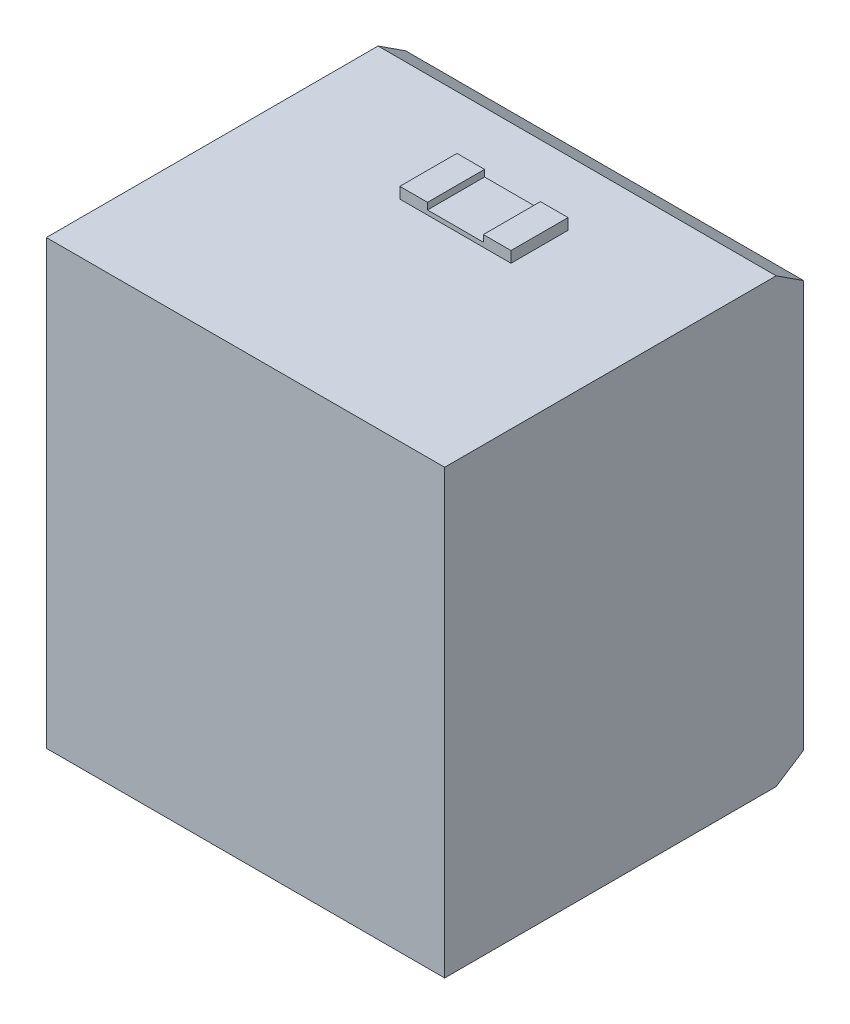
from build123d import *

# Parameters (mm, degrees)
BOSS_EXTRUDE1_DEPTH  = 1016
SKETCH2_W            = 834.909944441
SKETCH2_H            = 965.348785231
CUT_EXTRUDE1_DEPTH   = 723.9
SKETCH3_R            = 38.1
BOSS_EXTRUDE2_DEPTH  = 723.9
SKETCH4_R            = 21.824467542
BOSS_EXTRUDE3_DEPTH  = 3.556
LPATTERN4_COUNT      = 7
LPATTERN4_PITCH      = 114.3
LPATTERN4_COUNT_DIR2 = 9
LPATTERN4_PITCH_DIR2 = 104.14
BOSS_EXTRUDE5_REACH  = 1421.937
SKETCH5_W            = 25.790965235
SKETCH5_H            = 508
SKETCH6_W            = 255.319328018
SKETCH6_H            = 131.057449743
BOSS_EXTRUDE6_DEPTH  = 10.16
SKETCH7_W            = 63.5
SKETCH7_H            = 131.057449743
BOSS_EXTRUDE7_DEPTH  = 15.24


with BuildPart() as part:
    # Sketch1 → Boss-Extrude1 (new body)
    with BuildSketch(Plane(origin=(0, 0, 0), x_dir=(1, 0, 0), z_dir=(0, 1, 0))):
        Polygon((-457.2, -381), (-457.2, 381), (457.2, 380.492), (457.2, -380.492), align=None)
    extrude(amount=BOSS_EXTRUDE1_DEPTH)

    # Sketch2 → Cut-Extrude1 (cut)
    with BuildSketch(Plane(origin=(0.21152549, 0, -380.745882486), x_dir=(-0.9999998456790481, 0, -0.0005555554698215814), z_dir=(0.0005555554698215814, 0, -0.9999998456790481))):
        with Locations((0.106508893, 511.58382344)):
            Rectangle(SKETCH2_W, SKETCH2_H)
    extrude(amount=-CUT_EXTRUDE1_DEPTH, mode=Mode.SUBTRACT)

    # Sketch3 → Boss-Extrude2 (add)
    with BuildSketch(Plane(origin=(-0.190641114, 0, 343.154005801), x_dir=(-0.9999998456790481, 0, -0.0005555554698216001), z_dir=(0.0005555554698216001, 0, -0.9999998456790481))):
        with Locations((-351.253434757, 946.469423659)):
            Circle(SKETCH3_R)
    boss_extrude2 = extrude(amount=BOSS_EXTRUDE2_DEPTH)

    # Sketch4 → Boss-Extrude3 (add)
    with BuildSketch(Plane(origin=(0.21152549, 0, -380.745882486), x_dir=(-0.9999998456790481, 0, -0.0005555554698216001), z_dir=(0.0005555554698216001, 0, -0.9999998456790481))):
        with Locations((-354.287460121, 946.233273052)):
            Circle(SKETCH4_R)
    boss_extrude3 = extrude(amount=BOSS_EXTRUDE3_DEPTH)

    # LPattern4: Boss-Extrude2, Boss-Extrude3 7 × 9
    with Locations(*[Vector(-0.9999998456790481, 0, -0.0005555554698216149) * (i * LPATTERN4_PITCH) + Vector(0, -1, 0) * (j * LPATTERN4_PITCH_DIR2) for i in range(LPATTERN4_COUNT) for j in range(LPATTERN4_COUNT_DIR2) if (i, j) != (0, 0)]):
        add(boss_extrude2)
        add(boss_extrude3)

    # Boss-Extrude5: up to this face of the body (flat: up to its plane)
    boss_extrude5_end = Plane(part.part.faces().sort_by_distance((457.2, 508, 0))[0])
    # Sketch5 → Boss-Extrude5 (add, up to the picked face)
    with BuildSketch(Plane.ZY.offset(457.2), mode=Mode.PRIVATE) as boss_extrude5_sk1:
        with Locations((-368.104517383, 254)):
            Rectangle(SKETCH5_W, SKETCH5_H)
    boss_extrude5_tool1 = split(extrude(boss_extrude5_sk1.sketch, amount=-BOSS_EXTRUDE5_REACH, mode=Mode.PRIVATE), bisect_by=boss_extrude5_end, keep=Keep.BOTH, mode=Mode.PRIVATE)
    # Sketch5 → Boss-Extrude5 (add, up to the picked face)
    with BuildSketch(Plane.ZY.offset(457.2), mode=Mode.PRIVATE) as boss_extrude5_sk2:
        with Locations((-368.104517383, 762)):
            Rectangle(SKETCH5_W, SKETCH5_H)
    boss_extrude5_tool2 = split(extrude(boss_extrude5_sk2.sketch, amount=-BOSS_EXTRUDE5_REACH, mode=Mode.PRIVATE), bisect_by=boss_extrude5_end, keep=Keep.BOTH, mode=Mode.PRIVATE)
    # Sketch5 → Boss-Extrude5 (add, up to the picked face)
    with BuildSketch(Plane.ZY.offset(457.2), mode=Mode.PRIVATE) as boss_extrude5_sk3:
        Polygon((-444.109034765, 41.018337697), (-381, 0), (-381, 508), (-444.109034765, 508), align=None)
    boss_extrude5_tool3 = split(extrude(boss_extrude5_sk3.sketch, amount=-BOSS_EXTRUDE5_REACH, mode=Mode.PRIVATE), bisect_by=boss_extrude5_end, keep=Keep.BOTH, mode=Mode.PRIVATE)
    # Sketch5 → Boss-Extrude5 (add, up to the picked face)
    with BuildSketch(Plane.ZY.offset(457.2), mode=Mode.PRIVATE) as boss_extrude5_sk4:
        Polygon((-444.109034765, 508), (-381, 508), (-381, 1016), (-444.109034765, 974.981662303), align=None)
    boss_extrude5_tool4 = split(extrude(boss_extrude5_sk4.sketch, amount=-BOSS_EXTRUDE5_REACH, mode=Mode.PRIVATE), bisect_by=boss_extrude5_end, keep=Keep.BOTH, mode=Mode.PRIVATE)
    add(boss_extrude5_tool1.solids().sort_by(Axis((-457.2, 254, -368.104517), (1, 0, 0)))[0])
    add(boss_extrude5_tool2.solids().sort_by(Axis((-457.2, 762, -368.104517), (1, 0, 0)))[0])
    add(boss_extrude5_tool3.solids().sort_by(Axis((-457.2, 264.110778, -412.112009), (1, 0, 0)))[0])
    add(boss_extrude5_tool4.solids().sort_by(Axis((-457.2, 751.889222, -412.112009), (1, 0, 0)))[0])

    # Sketch6 → Boss-Extrude6 (add)
    with BuildSketch(Plane(origin=(0, 1016, 0), x_dir=(1, 0, 0), z_dir=(0, 1, 0))):
        with Locations((0, 166.980548784)):
            Rectangle(SKETCH6_W, SKETCH6_H)
    extrude(amount=BOSS_EXTRUDE6_DEPTH)

    # Sketch7 → Boss-Extrude7 (add)
    with BuildSketch(Plane(origin=(0, 1026.16, 0), x_dir=(1, 0, 0), z_dir=(0, 1, 0))):
        with Locations((-95.909664009, 166.980548784)):
            Rectangle(SKETCH7_W, SKETCH7_H)
        with Locations((95.909664009, 166.980548784)):
            Rectangle(SKETCH7_W, SKETCH7_H)
    extrude(amount=BOSS_EXTRUDE7_DEPTH)


solid = part.part
